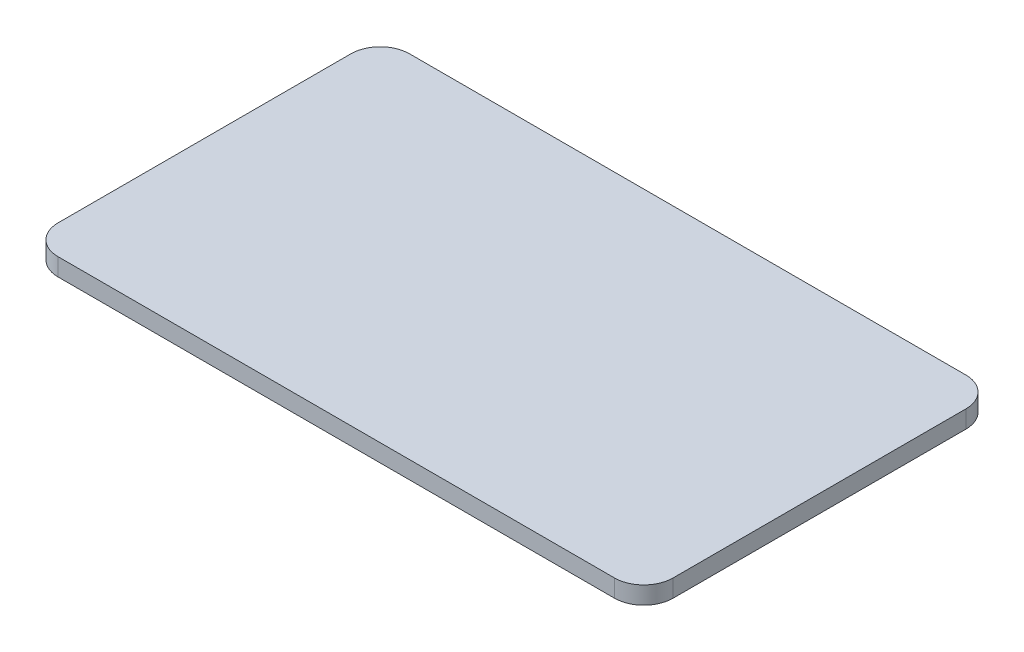
from build123d import *

# Parameters (mm, degrees)
BOSS_EXTRUDE1_DEPTH = 3


with BuildPart() as part:
    # Sketch1 → Boss-Extrude1 (new body)
    with BuildSketch(Plane(origin=(0, 0, 0), x_dir=(1, 0, 0), z_dir=(0, 1, 0))):
        with BuildLine():
            Line((47.5, -30), (-47.5, -30))
            ThreePointArc((-47.5, -30), (-51.035533906, -28.535533906), (-52.5, -25))
            Line((-52.5, -25), (-52.5, 25))
            ThreePointArc((-52.5, 25), (-51.035533906, 28.535533906), (-47.5, 30))
            Line((-47.5, 30), (47.5, 30))
            ThreePointArc((47.5, 30), (51.035533906, 28.535533906), (52.5, 25))
            Line((52.5, 25), (52.5, -25))
            ThreePointArc((52.5, -25), (51.035533906, -28.535533906), (47.5, -30))
        make_face()
    extrude(amount=BOSS_EXTRUDE1_DEPTH)


solid = part.part
